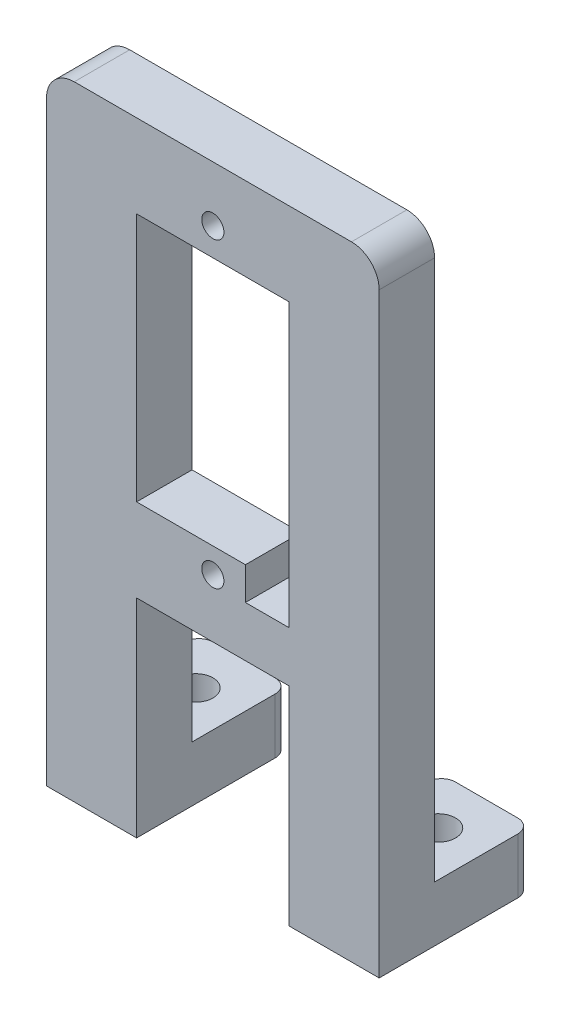
from build123d import *

# Parameters (mm, degrees)
SKETCH1_W           = 8.255
SKETCH1_H           = 19.05
SKETCH1_W_2         = 13.97
SKETCH1_H_2         = 22.86
BOSS_EXTRUDE1_DEPTH = 5.08
FILLET1_R           = 2.54
SKETCH3_W           = 8.255
SKETCH3_H           = 8.89
BOSS_EXTRUDE2_DEPTH = 5.08
SKETCH5_R           = 1.016
CUT_EXTRUDE1_DEPTH  = 5.08
SKETCH6_R           = 1.6
CUT_EXTRUDE2_DEPTH  = 5.08
FILLET2_R           = 1.27
SKETCH7_W           = 4
SKETCH7_H           = 3
CUT_EXTRUDE3_DEPTH  = 44.347762341


with BuildPart() as part:
    # Sketch1 → Boss-Extrude1 (new body)
    # profile 1 of 3: a face of its own
    with BuildSketch(Plane.XY):
        with Locations((-11.1125, -28.575)):
            Rectangle(SKETCH1_W, SKETCH1_H)
    # profile 2 of 3: a face of its own
    with BuildSketch(Plane.XY):
        Polygon((-15.24, 19.05), (-15.24, -19.05), (-6.985, -19.05), (6.985, -19.05), (15.24, -19.05), (15.24, 19.05), align=None)
        Rectangle(SKETCH1_W_2, SKETCH1_H_2, mode=Mode.SUBTRACT)
    # profile 3 of 3: a face of its own
    with BuildSketch(Plane.XY):
        with Locations((11.1125, -28.575)):
            Rectangle(SKETCH1_W, SKETCH1_H)
    extrude(amount=BOSS_EXTRUDE1_DEPTH)

    # Fillet1
    fillet1_edges = [part.edges().sort_by_distance(p)[0] for p in [
        (-15.24, 19.05, 2.54),
        (15.24, 19.05, 2.54),
    ]]
    fillet(fillet1_edges, radius=FILLET1_R)

    # Sketch3 → Boss-Extrude2 (add)
    with BuildSketch(Plane(origin=(0, -38.1, 0), x_dir=(1, 0, 0), z_dir=(0, 1, 0))):
        with Locations((-11.1125, 4.445)):
            Rectangle(SKETCH3_W, SKETCH3_H)
    boss_extrude2 = extrude(amount=BOSS_EXTRUDE2_DEPTH)

    # Sketch5 → Cut-Extrude1 (cut)
    with BuildSketch(Plane.XY.offset(5.08)):
        with Locations((0, 13.97)):
            Circle(SKETCH5_R)
        with Locations((0, -13.716)):
            Circle(SKETCH5_R)
    extrude(amount=-CUT_EXTRUDE1_DEPTH, mode=Mode.SUBTRACT)

    # Sketch6 → Cut-Extrude2 (cut)
    with BuildSketch(Plane(origin=(0, -33.02, 0), x_dir=(1, 0, 0), z_dir=(0, 1, 0))):
        with Locations(Location((-11.1125, 4.445, 0), (0, 0, 270))):
            Circle(SKETCH6_R)
    cut_extrude2 = extrude(amount=-CUT_EXTRUDE2_DEPTH, mode=Mode.SUBTRACT)

    # Mirror2: Boss-Extrude2, Cut-Extrude2 across plane
    add(boss_extrude2.mirror(Plane(origin=(0, 0, 0), x_dir=(0, 0, 1), z_dir=(1, 0, 0))))
    add(cut_extrude2.mirror(Plane(origin=(0, 0, 0), x_dir=(0, 0, 1), z_dir=(1, 0, 0))), mode=Mode.SUBTRACT)

    # Fillet2
    fillet2_edges = [part.edges().sort_by_distance(p)[0] for p in [
        (15.24, -35.56, -8.89),
        (6.985, -35.56, -8.89),
        (-6.985, -35.56, -8.89),
        (-15.24, -35.56, -8.89),
    ]]
    fillet(fillet2_edges, radius=FILLET2_R)

    # Sketch7 → Cut-Extrude3 (cut, through all)
    with BuildSketch(Plane.XY.offset(5.08)):
        with Locations((4.985, -12.93)):
            Rectangle(SKETCH7_W, SKETCH7_H)
    extrude(amount=-CUT_EXTRUDE3_DEPTH, mode=Mode.SUBTRACT)


solid = part.part
